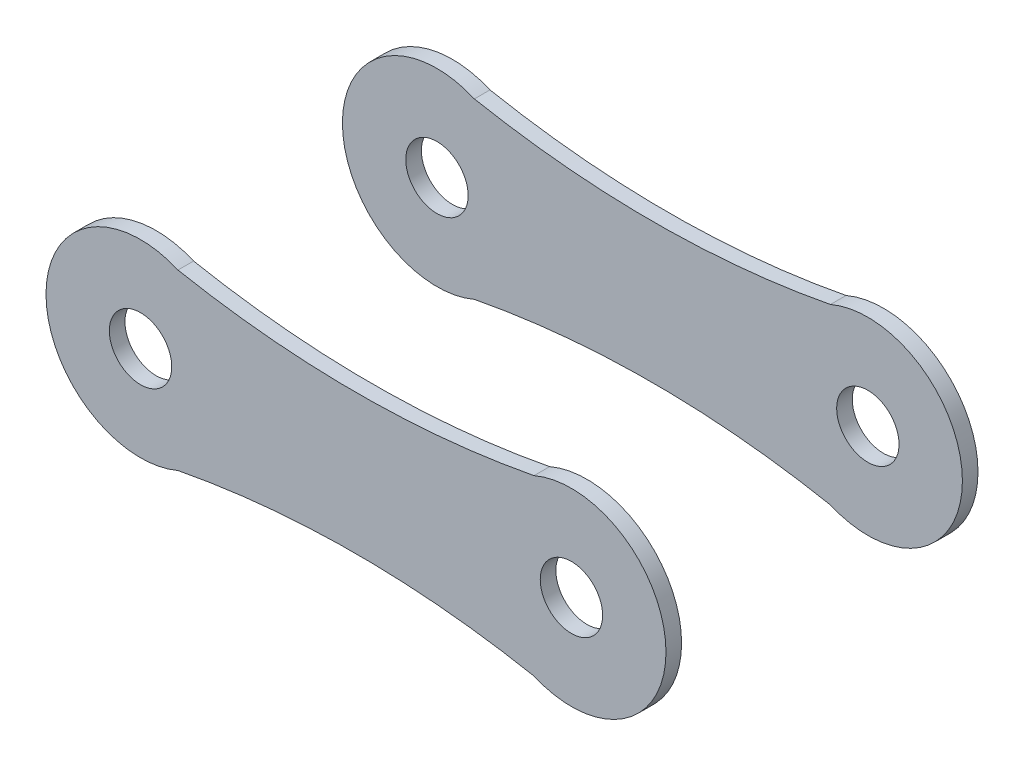
from build123d import *

# Parameters (mm, degrees)
EXTRUDE_1_DEPTH          = 0.5
EXTRUDE_2_DEPTH          = 0.5
CUT_EXTRUDE_1_DEPTH      = 20.818337468
CUT_EXTRUDE_1_DEPTH_BACK = 20.818337468
SKETCH_3_R               = 1


with BuildPart() as part:
    # 草图1 → 凸台-拉伸1 (new body)
    with BuildSketch(Plane.XY):
        with BuildLine():
            ThreePointArc((1.1999346, 2.782275499), (-3.03, 0), (1.1999346, -2.782275499))
            ThreePointArc((1.1999346, -2.782275499), (6.905, -2.238312691), (12.6100654, -2.782275499))
            ThreePointArc((12.6100654, -2.782275499), (16.84, 0), (12.6100654, 2.782275499))
            ThreePointArc((12.6100654, 2.782275499), (6.905, 2.238312691), (1.1999346, 2.782275499))
        make_face()
    extrude(amount=EXTRUDE_1_DEPTH)


with BuildPart() as body_2:
    # 草图2 → 凸台-拉伸2 (new body)
    with BuildSketch(Plane.XY.offset(-9)):
        with BuildLine():
            ThreePointArc((12.6100654, -2.782275499), (16.84, 0), (12.6100654, 2.782275499))
            ThreePointArc((12.6100654, 2.782275499), (6.905, 2.238312691), (1.1999346, 2.782275499))
            ThreePointArc((1.1999346, 2.782275499), (-3.03, 0), (1.1999346, -2.782275499))
            ThreePointArc((1.1999346, -2.782275499), (6.905, -2.238312691), (12.6100654, -2.782275499))
        make_face()
    extrude(amount=-EXTRUDE_2_DEPTH)


with BuildPart() as cut_extrude_1_tool:
    # 草图3 → 切除-拉伸1 (new, two sides: drawn at the far end of the back side and taken through both)
    with BuildSketch(Plane(origin=(0, 0, -9.5), x_dir=(-1, 0, 0), z_dir=(0, 0, -1)).offset(-CUT_EXTRUDE_1_DEPTH_BACK)):
        with Locations((-13.81, 0)):
            Circle(SKETCH_3_R)
        Circle(SKETCH_3_R)
    extrude(amount=CUT_EXTRUDE_1_DEPTH + CUT_EXTRUDE_1_DEPTH_BACK)


with BuildPart() as part_1:
    add(part.part)

    # 切除-拉伸1: cut by cut_extrude_1_tool
    add(cut_extrude_1_tool.part, mode=Mode.SUBTRACT)


with BuildPart() as body_2_1:
    add(body_2.part)

    # 切除-拉伸1: cut by cut_extrude_1_tool
    add(cut_extrude_1_tool.part, mode=Mode.SUBTRACT)


solid = Compound([part_1.part, body_2_1.part])
